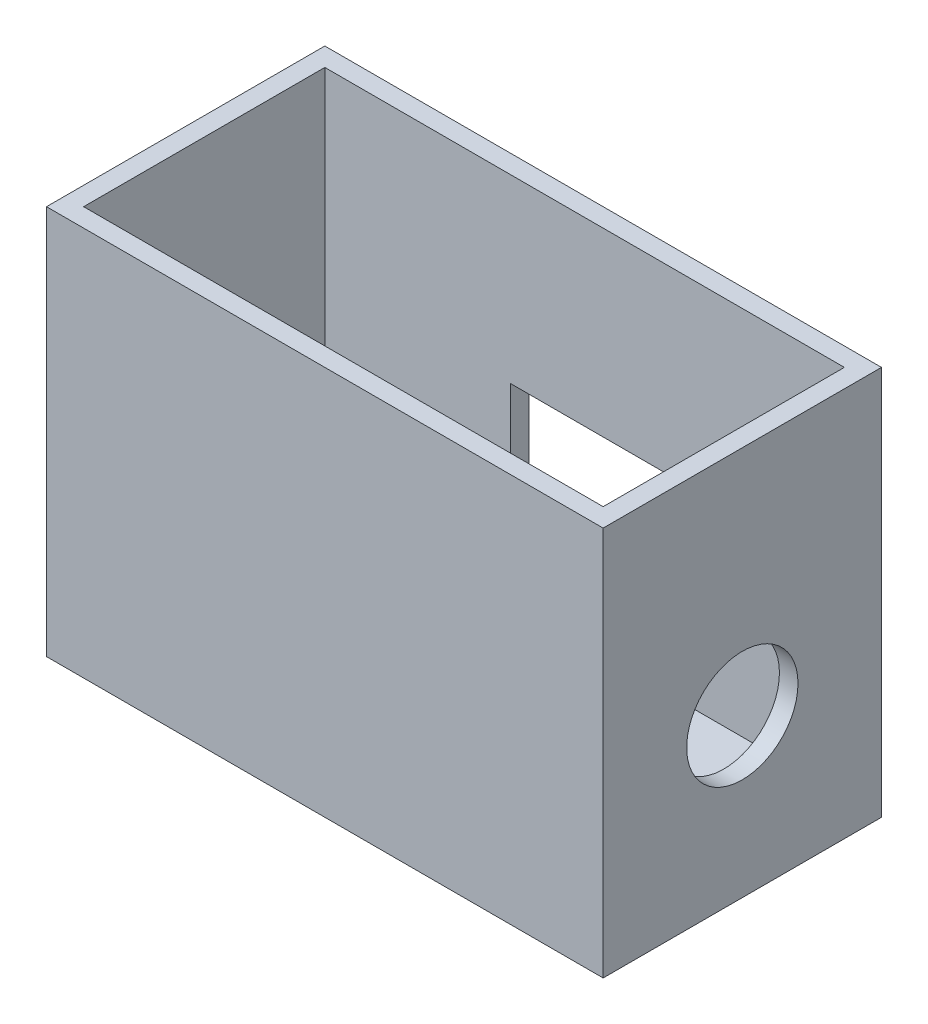
from build123d import *

# Parameters (mm, degrees)
SKETCH1_W           = 60
SKETCH1_H           = 30
BOSS_EXTRUDE1_DEPTH = 2
SKETCH2_W           = 60
SKETCH2_H           = 2
BOSS_EXTRUDE2_DEPTH = 40
SKETCH3_W           = 60
SKETCH3_H           = 2
BOSS_EXTRUDE3_DEPTH = 40
SKETCH4_W           = 2
SKETCH4_H           = 26
BOSS_EXTRUDE4_DEPTH = 40
SKETCH5_W           = 2
SKETCH5_H           = 26
BOSS_EXTRUDE5_DEPTH = 40
CUT_EXTRUDE3_REACH  = 81.145
SKETCH7_R           = 6
CUT_EXTRUDE4_REACH  = 81.145
SKETCH8_W           = 18
SKETCH8_H           = 12.5


with BuildPart() as part:
    # Sketch1 → Boss-Extrude1 (new body)
    with BuildSketch(Plane(origin=(0, 0, 0), x_dir=(1, 0, 0), z_dir=(0, 1, 0))):
        with Locations((30, -15)):
            Rectangle(SKETCH1_W, SKETCH1_H)
    extrude(amount=BOSS_EXTRUDE1_DEPTH)

    # Sketch2 → Boss-Extrude2 (add)
    with BuildSketch(Plane(origin=(0, 2, 0), x_dir=(1, 0, 0), z_dir=(0, 1, 0))):
        with Locations((30, -1)):
            Rectangle(SKETCH2_W, SKETCH2_H)
    extrude(amount=BOSS_EXTRUDE2_DEPTH)

    # Sketch3 → Boss-Extrude3 (add)
    with BuildSketch(Plane(origin=(0, 2, 0), x_dir=(1, 0, 0), z_dir=(0, 1, 0))):
        with Locations((30, -29)):
            Rectangle(SKETCH3_W, SKETCH3_H)
    extrude(amount=BOSS_EXTRUDE3_DEPTH)

    # Sketch4 → Boss-Extrude4 (add)
    with BuildSketch(Plane(origin=(0, 2, 0), x_dir=(1, 0, 0), z_dir=(0, 1, 0))):
        with Locations((1, -15)):
            Rectangle(SKETCH4_W, SKETCH4_H)
    extrude(amount=BOSS_EXTRUDE4_DEPTH)

    # Sketch5 → Boss-Extrude5 (add)
    with BuildSketch(Plane(origin=(0, 2, 0), x_dir=(1, 0, 0), z_dir=(0, 1, 0))):
        with Locations((59, -15)):
            Rectangle(SKETCH5_W, SKETCH5_H)
    extrude(amount=BOSS_EXTRUDE5_DEPTH)

    # Sketch7 → Cut-Extrude3 (cut, up to next)
    with BuildSketch(Plane(origin=(60, 0, 0), x_dir=(0, 0, -1), z_dir=(1, 0, 0)), mode=Mode.PRIVATE) as cut_extrude3_sk1:
        with Locations((-15, 17)):
            Circle(SKETCH7_R)
    cut_extrude3_tool1 = extrude(cut_extrude3_sk1.sketch, amount=-CUT_EXTRUDE3_REACH, mode=Mode.PRIVATE) & part.part
    add(cut_extrude3_tool1.solids().sort_by_distance((60, 17, 15))[0], mode=Mode.SUBTRACT)

    # Sketch8 → Cut-Extrude4 (cut, up to next)
    with BuildSketch(Plane(origin=(0, 0, 0), x_dir=(-1, 0, 0), z_dir=(0, 0, -1)), mode=Mode.PRIVATE) as cut_extrude4_sk1:
        with Locations((-31, 16.25)):
            Rectangle(SKETCH8_W, SKETCH8_H)
    cut_extrude4_tool1 = extrude(cut_extrude4_sk1.sketch, amount=-CUT_EXTRUDE4_REACH, mode=Mode.PRIVATE) & part.part
    add(cut_extrude4_tool1.solids().sort_by_distance((31, 16.25, 0))[0], mode=Mode.SUBTRACT)


solid = part.part
